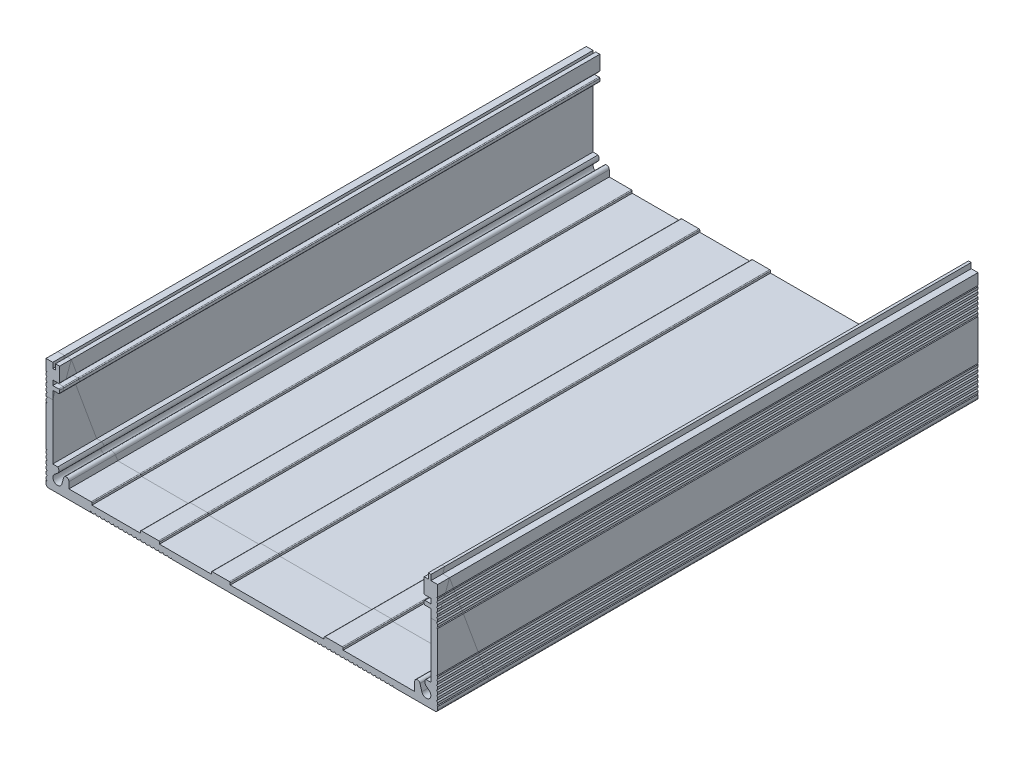
from build123d import *

# Parameters (mm, degrees)
BOSS_EXTRUDE1_DEPTH = 200
CUT_EXTRUDE1_DEPTH  = 217.669010244
FILLET1_R           = 1
FILLET3_R           = 0.3


with BuildPart() as part:
    # Sketch1 → Boss-Extrude1 (new body)
    with BuildSketch(Plane.XY):
        with BuildLine():
            Line((-72.5, -41.1), (-72.5, 0))
            Line((-72.5, 0), (-70, 0))
            Line((-70, 0), (-70, -2))
            Line((-70, -2), (-69, -2))
            Line((-69, -2), (-69, 0))
            Line((-69, 0), (-67.5, 0))
            Line((-67.5, 0), (-67.5, -5.65))
            Line((-67.5, -5.65), (-70, -5.65))
            Line((-70, -5.65), (-70, -7.45))
            Line((-70, -7.45), (-67.5, -7.45))
            Line((-67.5, -7.45), (-67.5, -8.95))
            Line((-67.5, -8.95), (-70, -8.95))
            Line((-70, -8.95), (-70, -32.6))
            Line((-70, -32.6), (-68.131966011, -32.6))
            ThreePointArc((-68.131966011, -32.6), (-67.756814431, -33.74281756), (-68.341794897, -34.793802116))
            Line((-68.341794897, -34.793802116), (-69.279299116, -35.507024269))
            ThreePointArc((-69.279299116, -35.507024269), (-69.204100214, -38.267015559), (-66.61218739, -37.315598348))
            Line((-66.61218739, -37.315598348), (-65.963419182, -34.983366994))
            ThreePointArc((-65.963419182, -34.983366994), (-64.864757962, -34.260553431), (-64, -35.251366022))
            Line((-64, -35.251366022), (-64, -37.6))
            Line((-64, -37.6), (-55.5, -37.6))
            Line((-55.5, -37.6), (-55.5, -38.56))
            Line((-55.5, -38.56), (-37.5, -38.56))
            Line((-37.5, -38.56), (-37.5, -37.6))
            Line((-37.5, -37.6), (-30.5, -37.6))
            Line((-30.5, -37.6), (-30.5, -38.56))
            Line((-30.5, -38.56), (-11.3, -38.56))
            Line((-11.3, -38.56), (-11.3, -37.6))
            Line((-11.3, -37.6), (-4.3, -37.6))
            Line((-4.3, -37.6), (-4.3, -38.56))
            Line((-4.3, -38.56), (30.5, -38.56))
            Line((30.5, -38.56), (30.5, -37.6))
            Line((30.5, -37.6), (37.5, -37.6))
            Line((37.5, -37.6), (37.5, -38.56))
            Line((37.5, -38.56), (64, -38.56))
            Line((64, -38.56), (64, -35.251366022))
            ThreePointArc((64, -35.251366022), (64.864757962, -34.260553431), (65.963419182, -34.983366994))
            Line((65.963419182, -34.983366994), (66.61218739, -37.315598348))
            ThreePointArc((66.61218739, -37.315598348), (69.204100214, -38.267015559), (69.279299116, -35.507024269))
            Line((69.279299116, -35.507024269), (68.341794897, -34.793802116))
            ThreePointArc((68.341794897, -34.793802116), (67.756814431, -33.74281756), (68.131966011, -32.6))
            Line((68.131966011, -32.6), (70, -32.6))
            Line((70, -32.6), (70, -8.95))
            Line((70, -8.95), (67.5, -8.95))
            Line((67.5, -8.95), (67.5, -7.45))
            Line((67.5, -7.45), (70, -7.45))
            Line((70, -7.45), (70, -5.65))
            Line((70, -5.65), (67.5, -5.65))
            Line((67.5, -5.65), (67.5, 0))
            Line((67.5, 0), (69, 0))
            Line((69, 0), (69, 2))
            Line((69, 2), (70, 2))
            Line((70, 2), (70, 0))
            Line((70, 0), (72.5, 0))
            Line((72.5, 0), (72.5, -41.1))
            Line((72.5, -41.1), (-72.5, -41.1))
        make_face()
    extrude(amount=-BOSS_EXTRUDE1_DEPTH)

    # Sketch3 → Cut-Extrude1 (cut, through all)
    with BuildSketch(Plane.XY):
        Polygon((-72.083333333, -29.1), (-72.916666667, -29.933333333), (-72.083333333, -30.766666667), (-72.916666667, -31.6), (-72.083333333, -32.433333333), (-72.916666667, -33.266666667), (-72.083333333, -34.1), (-72.916666667, -34.933333333), (-72.083333333, -35.766666667), (-72.916666667, -36.6), (-72.083333333, -37.433333333), (-72.916666667, -38.266666667), (-72.083333333, -39.1), (-75.083333333, -39.1), (-75.083333333, -29.1), align=None)
        Polygon((75.083333333, -29.1), (75.083333333, -39.1), (72.083333333, -39.1), (72.916666667, -38.266666667), (72.083333333, -37.433333333), (72.916666667, -36.6), (72.083333333, -35.766666667), (72.916666667, -34.933333333), (72.083333333, -34.1), (72.916666667, -33.266666667), (72.083333333, -32.433333333), (72.916666667, -31.6), (72.083333333, -30.766666667), (72.916666667, -29.933333333), (72.083333333, -29.1), align=None)
        Polygon((-72.083333333, -4.1), (-72.916666667, -4.933333333), (-72.083333333, -5.766666667), (-72.916666667, -6.6), (-72.083333333, -7.433333333), (-72.916666667, -8.266666667), (-72.083333333, -9.1), (-72.916666667, -9.933333333), (-72.083333333, -10.766666667), (-72.916666667, -11.6), (-72.083333333, -12.433333333), (-72.916666667, -13.266666667), (-72.083333333, -14.1), (-75.083333333, -14.1), (-75.083333333, -4.1), align=None)
        Polygon((75.083333333, -14.1), (72.083333333, -14.1), (72.916666667, -13.266666667), (72.083333333, -12.433333333), (72.916666667, -11.6), (72.083333333, -10.766666667), (72.916666667, -9.933333333), (72.083333333, -9.1), (72.916666667, -8.266666667), (72.083333333, -7.433333333), (72.916666667, -6.6), (72.083333333, -5.766666667), (72.916666667, -4.933333333), (72.083333333, -4.1), (75.083333333, -4.1), align=None)
        Polygon((-55.12340171, -41.497043021), (-55.956735043, -40.663709687), (-55.956735043, -45.411897706), (-25.956735043, -45.411897706), (-25.956735043, -40.663709687), (-26.790068377, -41.497043021), (-27.62340171, -40.663709687), (-28.456735043, -41.497043021), (-29.290068377, -40.663709687), (-30.12340171, -41.497043021), (-30.956735043, -40.663709687), (-31.790068377, -41.497043021), (-32.62340171, -40.663709687), (-33.456735043, -41.497043021), (-34.290068377, -40.663709687), (-35.12340171, -41.497043021), (-35.956735043, -40.663709687), (-36.790068377, -41.497043021), (-37.62340171, -40.663709687), (-38.456735043, -41.497043021), (-39.290068377, -40.663709687), (-40.12340171, -41.497043021), (-40.956735043, -40.663709687), (-41.790068377, -41.497043021), (-42.62340171, -40.663709687), (-43.456735043, -41.497043021), (-44.290068377, -40.663709687), (-45.12340171, -41.497043021), (-45.956735043, -40.663709687), (-46.790068377, -41.497043021), (-47.62340171, -40.663709687), (-48.456735043, -41.497043021), (-49.290068377, -40.663709687), (-50.12340171, -41.497043021), (-50.956735043, -40.663709687), (-51.790068377, -41.497043021), (-52.62340171, -40.663709687), (-53.456735043, -41.497043021), (-54.290068377, -40.663709687), align=None)
        Polygon((25.956735043, -45.411897706), (55.956735043, -45.411897706), (55.956735043, -40.663709687), (55.12340171, -41.497043021), (54.290068377, -40.663709687), (53.456735043, -41.497043021), (52.62340171, -40.663709687), (51.790068377, -41.497043021), (50.956735043, -40.663709687), (50.12340171, -41.497043021), (49.290068377, -40.663709687), (48.456735043, -41.497043021), (47.62340171, -40.663709687), (46.790068377, -41.497043021), (45.956735043, -40.663709687), (45.12340171, -41.497043021), (44.290068377, -40.663709687), (43.456735043, -41.497043021), (42.62340171, -40.663709687), (41.790068377, -41.497043021), (40.956735043, -40.663709687), (40.12340171, -41.497043021), (39.290068377, -40.663709687), (38.456735043, -41.497043021), (37.62340171, -40.663709687), (36.790068377, -41.497043021), (35.956735043, -40.663709687), (35.12340171, -41.497043021), (34.290068377, -40.663709687), (33.456735043, -41.497043021), (32.62340171, -40.663709687), (31.790068377, -41.497043021), (30.956735043, -40.663709687), (30.12340171, -41.497043021), (29.290068377, -40.663709687), (28.456735043, -41.497043021), (27.62340171, -40.663709687), (26.790068377, -41.497043021), (25.956735043, -40.663709687), align=None)
    extrude(amount=-CUT_EXTRUDE1_DEPTH, mode=Mode.SUBTRACT)

    # Fillet1
    fillet1_edges = [part.edges().sort_by_distance(p)[0] for p in [
        (-72.5, -41.1, -100),
        (72.5, -41.1, -100),
    ]]
    fillet(fillet1_edges, radius=FILLET1_R)

    # Fillet3
    fillet3_edges = [part.edges().sort_by_distance(p)[0] for p in [
        (-67.5, -5.65, -100),
        (-67.5, -7.45, -100),
        (-67.5, -8.95, -100),
        (-55.5, -37.6, -100),
        (-37.5, -37.6, -100),
        (-30.5, -37.6, -100),
        (-11.3, -37.6, -100),
        (-4.3, -37.6, -100),
        (30.5, -37.6, -100),
        (37.5, -37.6, -100),
        (67.5, -8.95, -100),
        (67.5, -7.45, -100),
        (67.5, -5.65, -100),
    ]]
    fillet(fillet3_edges, radius=FILLET3_R)


with BuildPart() as body_2:
    # Split1: the piece on the far side of the plane
    add(part.part)
    split(bisect_by=Plane(origin=(0, -1.403733341, -3.856725658), x_dir=(0, 0.9396926207859081, -0.34202014332566943), z_dir=(0, 0.34202014332566943, 0.9396926207859081)), keep=Keep.BOTTOM)


with BuildPart() as part_1:
    add(part.part)

    # Split1
    split(bisect_by=Plane(origin=(0, -1.403733341, -3.856725658), x_dir=(0, 0.9396926207859081, -0.34202014332566943), z_dir=(0, 0.34202014332566943, 0.9396926207859081)), keep=Keep.TOP)


with BuildPart() as body_3:
    # Split2: the piece on the far side of the plane
    add(body_2.part)
    split(bisect_by=Plane(origin=(0, 1.403733341, -3.856725658), x_dir=(0, 0.9396926207859081, 0.34202014332566943), z_dir=(0, -0.34202014332566943, 0.9396926207859081)), keep=Keep.BOTTOM)


with BuildPart() as body_2_1:
    add(body_2.part)

    # Split2
    split(bisect_by=Plane(origin=(0, 1.403733341, -3.856725658), x_dir=(0, 0.9396926207859081, 0.34202014332566943), z_dir=(0, -0.34202014332566943, 0.9396926207859081)), keep=Keep.TOP)


solid = Compound([part_1.part, body_3.part, body_2_1.part])
